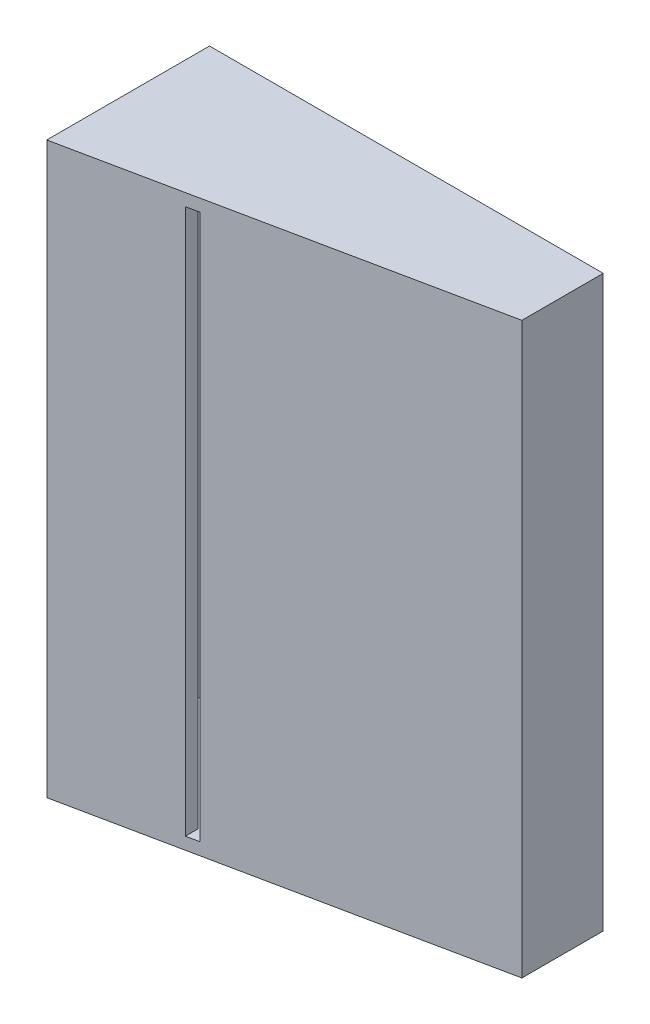
from build123d import *

# Parameters (mm, degrees)
SKETCH1_W           = 2.9
SKETCH1_H           = 19.8
BOSS_EXTRUDE1_DEPTH = 1.5
SKETCH2_W           = 22.5
SKETCH2_H           = 26
BOSS_EXTRUDE3_DEPTH = 1.5
BOSS_EXTRUDE4_DEPTH = 20
CUT_EXTRUDE1_DEPTH  = 70
CUT_EXTRUDE2_START  = -35
CUT_EXTRUDE2_DEPTH  = 33.5
CUT_EXTRUDE3_REACH  = 80.921
SKETCH6_W           = 1.5
SKETCH6_H           = 67


with BuildPart() as part:
    # Sketch1 → Boss-Extrude1 (new body)
    with BuildSketch(Plane.XY):
        with Locations((-45.437495374, 25.25)):
            Rectangle(SKETCH1_W, SKETCH1_H)
    extrude(amount=-BOSS_EXTRUDE1_DEPTH)

    # Sketch2 → Boss-Extrude3 (add)
    with BuildSketch(Plane(origin=(0, 0, -1.5), x_dir=(-1, 0, 0), z_dir=(0, 0, -1))):
        with Locations((35.637495374, 25.25)):
            Rectangle(SKETCH2_W, SKETCH2_H)
    extrude(amount=BOSS_EXTRUDE3_DEPTH)

    # Sketch3 → Boss-Extrude4 (add)
    with BuildSketch(Plane.XY):
        Polygon((-46.887495374, 15.25), (-46.887495374, 35.25), (-46.887495374, 60.25), (1.5, 60.25), (1.5, -9.75), (-46.887495374, -9.75), align=None)
    extrude(amount=BOSS_EXTRUDE4_DEPTH)

    # Sketch4 → Cut-Extrude1 (cut)
    with BuildSketch(Plane.XZ.offset(9.75)):
        Polygon((-46.887495374, 20), (1.5, 10), (1.5, 20), align=None)
    extrude(amount=-CUT_EXTRUDE1_DEPTH, mode=Mode.SUBTRACT)

    # Sketch5 → Cut-Extrude2 (cut)
    with BuildSketch(Plane.XZ.offset(9.75).offset(CUT_EXTRUDE2_START)):
        Polygon((0, 1.5), (0, 8.778299559), (-46.887495374, 18.468302113), (-46.887495374, 1.5), align=None)
    cut_extrude2 = extrude(amount=CUT_EXTRUDE2_DEPTH, mode=Mode.SUBTRACT)

    # Mirror1: Cut-Extrude2 across plane
    add(cut_extrude2.mirror(Plane.ZX.offset(25.25)), mode=Mode.SUBTRACT)

    # Cut-Extrude3: up to this plane
    cut_extrude3_end = Plane(origin=(-46.887495374, 109.660016278, 20), z_dir=(-0.20238811385578315, 0, -0.9793053922908311))
    # Sketch6 → Cut-Extrude3 (cut, up to the surface)
    with BuildSketch(Plane(origin=(0, 0, 0), x_dir=(-1, 0, 0), z_dir=(0, 0, -1)), mode=Mode.PRIVATE) as cut_extrude3_sk1:
        with Locations((32.02, 25.25)):
            Rectangle(SKETCH6_W, SKETCH6_H)
    cut_extrude3_tool1 = split(extrude(cut_extrude3_sk1.sketch, amount=-CUT_EXTRUDE3_REACH, mode=Mode.PRIVATE), bisect_by=cut_extrude3_end, keep=Keep.BOTH, mode=Mode.PRIVATE)
    add(cut_extrude3_tool1.solids().sort_by_distance((-32.02, 25.25, 0))[0], mode=Mode.SUBTRACT)


solid = part.part
